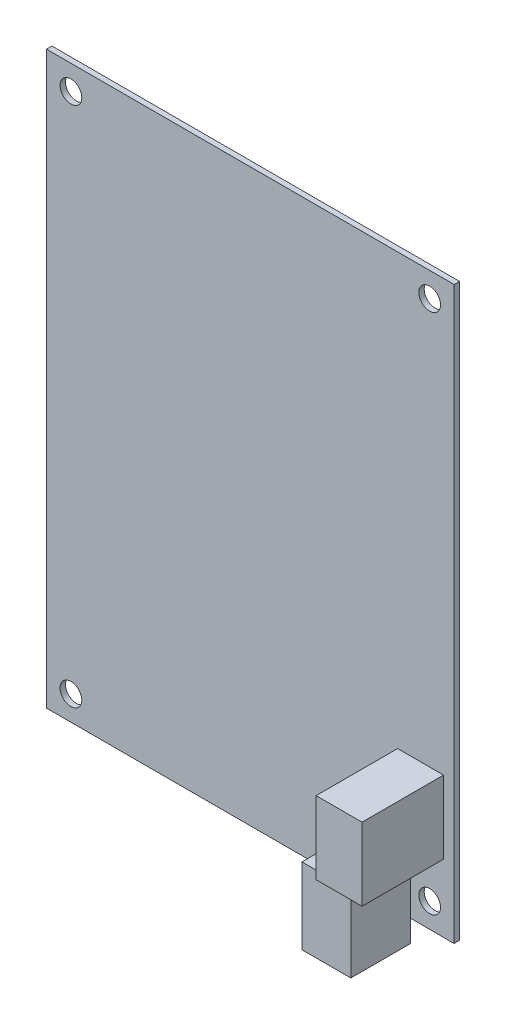
from build123d import *

# Parameters (mm, degrees)
ESQUISSE1_W               = 75
ESQUISSE1_H               = 105
BOSS_EXTRU_1_DEPTH        = 1
ENL_V_MAT_EXTRU_1_REACH   = 66.525
ESQUISSE3_R               = 2
SYM_TRIE2_COPY_1_REACH    = 66.525
SYM_TRIE2_COPY_1_SKETCH_R = 2
ESQUISSE5_W               = 9
ESQUISSE5_H               = 11
BOSS_EXTRU_3_DEPTH        = 10
ESQUISSE5_2_W             = 9
ESQUISSE5_2_H             = 11
BOSS_EXTRU_4_DEPTH        = 4
ESQUISSE6_W               = 8.451892611
ESQUISSE6_H               = 13.39545244
BOSS_EXTRU_5_DEPTH        = 15


with BuildPart() as part:
    # Esquisse1 → Boss.-Extru.1 (new body)
    with BuildSketch(Plane.XY):
        Rectangle(ESQUISSE1_W, ESQUISSE1_H)
    extrude(amount=BOSS_EXTRU_1_DEPTH)

    # Esquisse3 → Enlèv. mat.-Extru.1 (cut, up to next)
    with BuildSketch(Plane.XY.offset(1), mode=Mode.PRIVATE) as enl_v_mat_extru_1_sk1:
        with Locations((-33, -48)):
            Circle(ESQUISSE3_R)
    enl_v_mat_extru_1_tool1 = extrude(enl_v_mat_extru_1_sk1.sketch, amount=-ENL_V_MAT_EXTRU_1_REACH, mode=Mode.PRIVATE) & part.part
    enl_v_mat_extru_1 = enl_v_mat_extru_1_tool1.solids().sort_by_distance((-33, -48, 1))[0]
    add(enl_v_mat_extru_1, mode=Mode.SUBTRACT)

    # Symétrie1: Enlèv. mat.-Extru.1 across plane
    add(enl_v_mat_extru_1.mirror(Plane(origin=(0, 0, 0), x_dir=(0, 0, 1), z_dir=(1, 0, 0))), mode=Mode.SUBTRACT)

    # Symétrie2: Enlèv. mat.-Extru.1 across plane
    add(enl_v_mat_extru_1.mirror(Plane.ZX), mode=Mode.SUBTRACT)

    # Symétrie2 copy 1 sketch → Symétrie2 copy 1 (cut, up to next)
    with BuildSketch(Plane(origin=(0, 0, 1), x_dir=(-1, 0, 0), z_dir=(0, 0, 1)), mode=Mode.PRIVATE) as sym_trie2_copy_1_sk1:
        with Locations((-33, -48)):
            Circle(SYM_TRIE2_COPY_1_SKETCH_R)
    sym_trie2_copy_1_tool1 = extrude(sym_trie2_copy_1_sk1.sketch, amount=-SYM_TRIE2_COPY_1_REACH, mode=Mode.PRIVATE) & part.part
    add(sym_trie2_copy_1_tool1.solids().sort_by_distance((33, 48, 1))[0], mode=Mode.SUBTRACT)

    # Esquisse5 → Boss.-Extru.3 (add)
    with BuildSketch(Plane.XZ.offset(52.5)):
        with Locations((25, 6.5)):
            Rectangle(ESQUISSE5_W, ESQUISSE5_H)
    extrude(amount=-BOSS_EXTRU_3_DEPTH)

    # Esquisse5<2> → Boss.-Extru.4 (add)
    with BuildSketch(Plane.XZ.offset(52.5)):
        with Locations((25, 6.5)):
            Rectangle(ESQUISSE5_2_W, ESQUISSE5_2_H)
    extrude(amount=BOSS_EXTRU_4_DEPTH)

    # Esquisse6 → Boss.-Extru.5 (add)
    with BuildSketch(Plane.XY.offset(1)):
        with Locations((31.335790529, -33.335790529)):
            Rectangle(ESQUISSE6_W, ESQUISSE6_H)
    extrude(amount=BOSS_EXTRU_5_DEPTH)


solid = part.part
